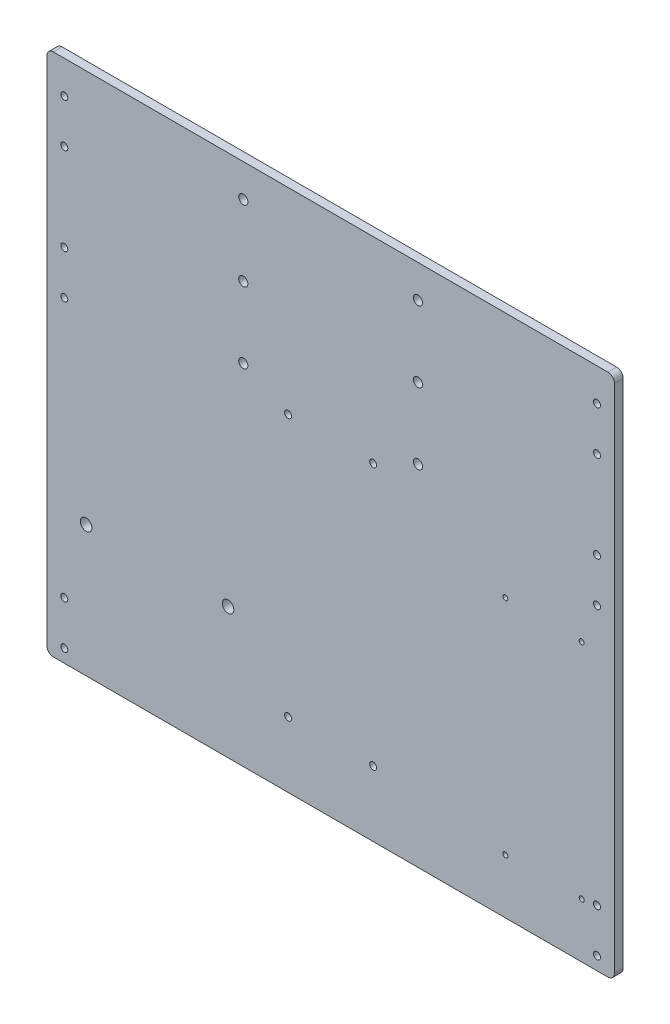
from build123d import *

# Parameters (mm, degrees)
SKETCH_1_W          = 260
SKETCH_1_H          = 240
EXTRUDE_1_DEPTH     = 4
SKETCH_2_R          = 1.6
CUT_EXTRUDE_1_DEPTH = 63
SKETCH_3_R          = 1.15
CUT_EXTRUDE_2_DEPTH = 60
FILLET_1_R          = 3
SKETCH_4_R          = 2.65
SKETCH_4_R_2        = 2.1
CUT_EXTRUDE_3_DEPTH = 10
SKETCH_5_R          = 1.6
CUT_EXTRUDE_4_DEPTH = 10


with BuildPart() as part:
    # 草图1 → 凸台-拉伸1 (new body)
    with BuildSketch(Plane.XY):
        Rectangle(SKETCH_1_W, SKETCH_1_H)
    extrude(amount=EXTRUDE_1_DEPTH)

    # 草图2 → 切除-拉伸1 (cut)
    with BuildSketch(Plane(origin=(0, 0, 0), x_dir=(-1, 0, 0), z_dir=(0, 0, -1))):
        with Locations((-19.5, 30)):
            Circle(SKETCH_2_R)
        with Locations((19.5, 30)):
            Circle(SKETCH_2_R)
        with Locations((19.5, -90)):
            Circle(SKETCH_2_R)
        with Locations((-19.5, -90)):
            Circle(SKETCH_2_R)
    extrude(amount=-CUT_EXTRUDE_1_DEPTH, mode=Mode.SUBTRACT)

    # 草图3 → 切除-拉伸2 (cut)
    with BuildSketch(Plane.XY.offset(4)):
        with Locations((80, 7)):
            Circle(SKETCH_3_R)
        with Locations((115, 7)):
            Circle(SKETCH_3_R)
        with Locations((115, -95)):
            Circle(SKETCH_3_R)
        with Locations((80, -95)):
            Circle(SKETCH_3_R)
    extrude(amount=-CUT_EXTRUDE_2_DEPTH, mode=Mode.SUBTRACT)

    # 圆角1
    fillet_1_edges = [part.edges().sort_by_distance(p)[0] for p in [
        (-130, 120, 2),
        (130, 120, 2),
        (130, -120, 2),
        (-130, -120, 2),
    ]]
    fillet(fillet_1_edges, radius=FILLET_1_R)

    # 草图4 → 切除-拉伸3 (cut)
    with BuildSketch(Plane.XY.offset(4)):
        with Locations((-112, -60)):
            Circle(SKETCH_4_R)
        with Locations((-47, -60)):
            Circle(SKETCH_4_R)
        with Locations((-40, 105)):
            Circle(SKETCH_4_R_2)
        with Locations((-40, 40)):
            Circle(SKETCH_4_R_2)
        with Locations((40, 40)):
            Circle(SKETCH_4_R_2)
        with Locations((40, 105)):
            Circle(SKETCH_4_R_2)
        with Locations((-40, 72.5)):
            Circle(SKETCH_4_R_2)
        with Locations((40, 72.5)):
            Circle(SKETCH_4_R_2)
    extrude(amount=-CUT_EXTRUDE_3_DEPTH, mode=Mode.SUBTRACT)

    # 草图5 → 切除-拉伸4 (cut)
    with BuildSketch(Plane.XY.offset(4)):
        with Locations((-122, 105)):
            Circle(SKETCH_5_R)
        with Locations((-122, 85)):
            Circle(SKETCH_5_R)
        with Locations((-122, 45)):
            Circle(SKETCH_5_R)
        with Locations((-122, 25)):
            Circle(SKETCH_5_R)
        with Locations((-122, -94)):
            Circle(SKETCH_5_R)
        with Locations((-122, -114)):
            Circle(SKETCH_5_R)
        with Locations((122, -114)):
            Circle(SKETCH_5_R)
        with Locations((122, -94)):
            Circle(SKETCH_5_R)
        with Locations((122, 25)):
            Circle(SKETCH_5_R)
        with Locations((122, 45)):
            Circle(SKETCH_5_R)
        with Locations((122, 85)):
            Circle(SKETCH_5_R)
        with Locations((122, 105)):
            Circle(SKETCH_5_R)
    extrude(amount=-CUT_EXTRUDE_4_DEPTH, mode=Mode.SUBTRACT)


solid = part.part
